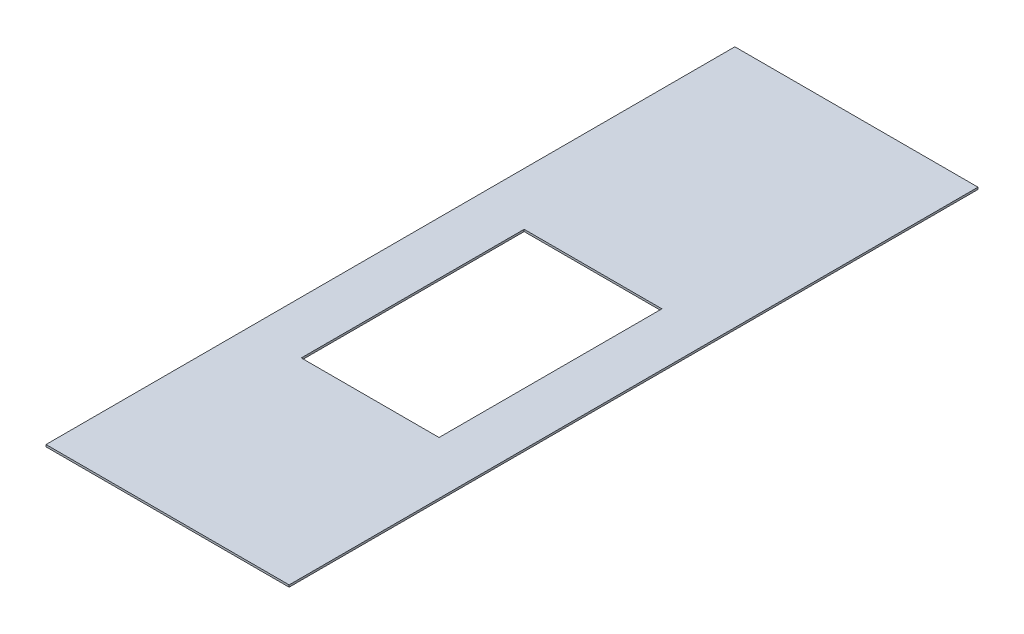
from build123d import *

# Parameters (mm, degrees)
SKETCH1_W           = 60
SKETCH1_H           = 170
BOSS_EXTRUDE1_DEPTH = 0.5
SKETCH2_W           = 34
SKETCH2_H           = 55
CUT_EXTRUDE1_DEPTH  = 10


with BuildPart() as part:
    # Sketch1 → Boss-Extrude1 (new body)
    with BuildSketch(Plane(origin=(0, 0, 0), x_dir=(1, 0, 0), z_dir=(0, 1, 0))):
        Rectangle(SKETCH1_W, SKETCH1_H)
    extrude(amount=BOSS_EXTRUDE1_DEPTH)

    # Sketch2 → Cut-Extrude1 (cut)
    with BuildSketch(Plane.XZ):
        with Locations((0, 7.5)):
            Rectangle(SKETCH2_W, SKETCH2_H)
    extrude(amount=-CUT_EXTRUDE1_DEPTH, mode=Mode.SUBTRACT)


solid = part.part
